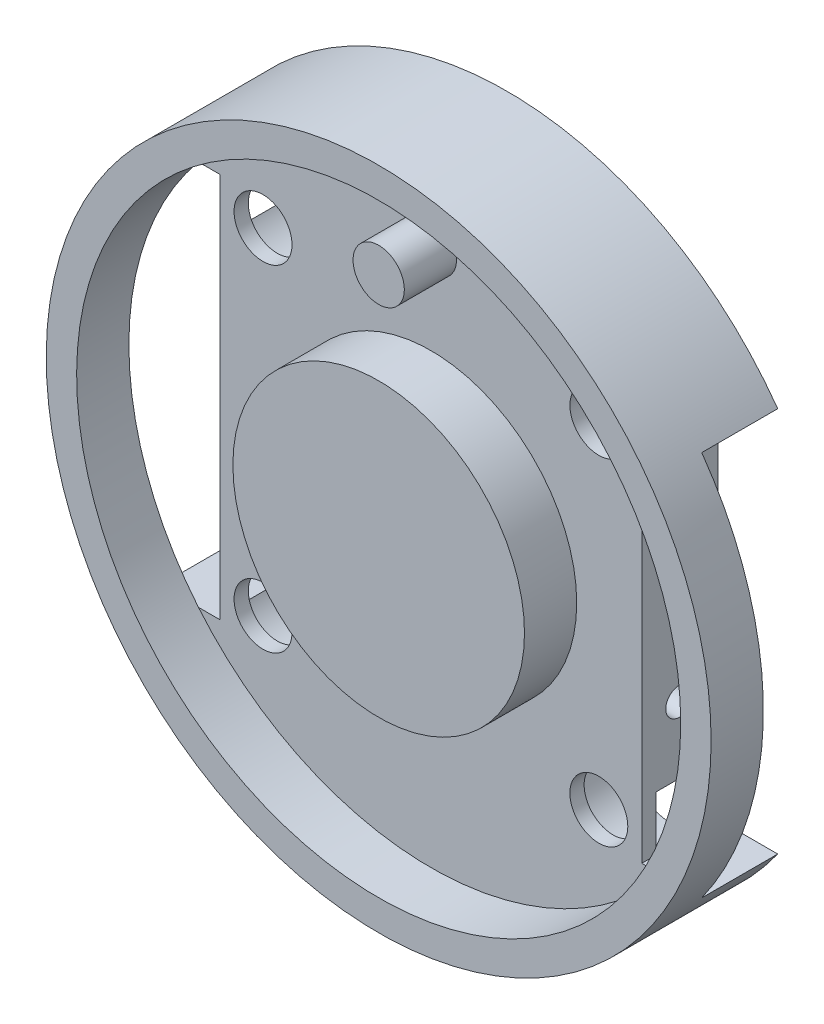
from build123d import *

# Parameters (mm, degrees)
BOSS_EXTRUDE1_DEPTH     = 8
CUT_EXTRUDE1_REACH      = 47.847
SKETCH2_R               = 3.05
SKETCH5_R               = 2.7
BOSS_EXTRUDE2_DEPTH     = 5.5
SKETCH6_R               = 15.35
BOSS_EXTRUDE3_DEPTH     = 5.5
SKETCH7_R               = 5.5
CUT_EXTRUDE2_DEPTH      = 6.5
CUT_EXTRUDE3_DEPTH      = 52.305457799
CUT_EXTRUDE3_DEPTH_BACK = 52.305457799
SKETCH8_R               = 1.475


with BuildPart() as part:
    # Sketch1 → Boss-Extrude1 (new body)
    with BuildSketch(Plane.XY):
        with BuildLine():
            Line((28.511576596, -20.3), (22.2, -20.3))
            Line((22.2, -20.3), (22.2, 20.3))
            Line((22.2, 20.3), (28.511576596, 20.3))
            ThreePointArc((28.511576596, 20.3), (0, 35), (-28.511576596, 20.3))
            Line((-28.511576596, 20.3), (-22.2, 20.3))
            Line((-22.2, 20.3), (-22.2, -20.3))
            Line((-22.2, -20.3), (-28.511576596, -20.3))
            ThreePointArc((-28.511576596, -20.3), (0, -35), (28.511576596, -20.3))
        make_face()
    extrude(amount=BOSS_EXTRUDE1_DEPTH)

    # Sketch2 → Cut-Extrude1 (cut, up to next)
    with BuildSketch(Plane.XY.offset(8), mode=Mode.PRIVATE) as cut_extrude1_sk1:
        with Locations((17.67766953, -17.67766953)):
            Circle(SKETCH2_R)
    cut_extrude1_tool1 = extrude(cut_extrude1_sk1.sketch, amount=-CUT_EXTRUDE1_REACH, mode=Mode.PRIVATE) & part.part
    # Sketch2 → Cut-Extrude1 (cut, up to next)
    with BuildSketch(Plane.XY.offset(8), mode=Mode.PRIVATE) as cut_extrude1_sk2:
        with Locations((17.67766953, 17.67766953)):
            Circle(SKETCH2_R)
    cut_extrude1_tool2 = extrude(cut_extrude1_sk2.sketch, amount=-CUT_EXTRUDE1_REACH, mode=Mode.PRIVATE) & part.part
    # Sketch2 → Cut-Extrude1 (cut, up to next)
    with BuildSketch(Plane.XY.offset(8), mode=Mode.PRIVATE) as cut_extrude1_sk3:
        with Locations((-17.67766953, 17.67766953)):
            Circle(SKETCH2_R)
    cut_extrude1_tool3 = extrude(cut_extrude1_sk3.sketch, amount=-CUT_EXTRUDE1_REACH, mode=Mode.PRIVATE) & part.part
    # Sketch2 → Cut-Extrude1 (cut, up to next)
    with BuildSketch(Plane.XY.offset(8), mode=Mode.PRIVATE) as cut_extrude1_sk4:
        with Locations((-17.67766953, -17.67766953)):
            Circle(SKETCH2_R)
    cut_extrude1_tool4 = extrude(cut_extrude1_sk4.sketch, amount=-CUT_EXTRUDE1_REACH, mode=Mode.PRIVATE) & part.part
    add(cut_extrude1_tool1.solids().sort_by_distance((17.67767, -17.67767, 8))[0], mode=Mode.SUBTRACT)
    add(cut_extrude1_tool2.solids().sort_by_distance((17.67767, 17.67767, 8))[0], mode=Mode.SUBTRACT)
    add(cut_extrude1_tool3.solids().sort_by_distance((-17.67767, 17.67767, 8))[0], mode=Mode.SUBTRACT)
    add(cut_extrude1_tool4.solids().sort_by_distance((-17.67767, -17.67767, 8))[0], mode=Mode.SUBTRACT)

    # Sketch5 → Boss-Extrude2 (add)
    with BuildSketch(Plane.XY.offset(8)):
        with BuildLine():
            ThreePointArc((-24.477540726, -20.3), (-31.8, 0), (-24.477540726, 20.3))
            Line((-24.477540726, 20.3), (-28.511576596, 20.3))
            ThreePointArc((-28.511576596, 20.3), (-35, 0), (-28.511576596, -20.3))
            Line((-28.511576596, -20.3), (-24.477540726, -20.3))
        make_face()
        with BuildLine():
            ThreePointArc((-24.477540726, 20.3), (0, 31.8), (24.477540726, 20.3))
            Line((24.477540726, 20.3), (28.511576596, 20.3))
            ThreePointArc((28.511576596, 20.3), (0, 35), (-28.511576596, 20.3))
            Line((-28.511576596, 20.3), (-24.477540726, 20.3))
        make_face()
        with BuildLine():
            ThreePointArc((24.477540726, 20.3), (29.913423367, 10.79013913), (31.8, 0))
            ThreePointArc((31.8, 0), (29.913423367, -10.79013913), (24.477540726, -20.3))
            Line((24.477540726, -20.3), (28.511576596, -20.3))
            ThreePointArc((28.511576596, -20.3), (33.33845513, -10.655862685), (35, 0))
            ThreePointArc((35, 0), (33.33845513, 10.655862685), (28.511576596, 20.3))
            Line((28.511576596, 20.3), (24.477540726, 20.3))
        make_face()
        with BuildLine():
            Line((28.511576596, -20.3), (24.477540726, -20.3))
            ThreePointArc((24.477540726, -20.3), (0, -31.8), (-24.477540726, -20.3))
            Line((-24.477540726, -20.3), (-28.511576596, -20.3))
            ThreePointArc((-28.511576596, -20.3), (0, -35), (28.511576596, -20.3))
        make_face()
        with Locations((0, 25)):
            Circle(SKETCH5_R)
    extrude(amount=BOSS_EXTRUDE2_DEPTH)

    # Sketch6 → Boss-Extrude3 (add)
    with BuildSketch(Plane.XY.offset(8)):
        with Locations(Location((0, 0, 0), (0, 0, 180))):
            Circle(SKETCH6_R)
    extrude(amount=BOSS_EXTRUDE3_DEPTH)

    # Sketch7 → Cut-Extrude2 (cut)
    with BuildSketch(Plane(origin=(0, 0, 0), x_dir=(-1, 0, 0), z_dir=(0, 0, -1))):
        with Locations((-17.67766953, 17.67766953)):
            Circle(SKETCH7_R)
        with Locations((17.67766953, 17.67766953)):
            Circle(SKETCH7_R)
        with Locations((17.67766953, -17.67766953)):
            Circle(SKETCH7_R)
        with Locations((-17.67766953, -17.67766953)):
            Circle(SKETCH7_R)
    extrude(amount=-CUT_EXTRUDE2_DEPTH, mode=Mode.SUBTRACT)

    # Sketch8 → Cut-Extrude3 (cut, two sides: drawn at the far end of the back side and taken through both)
    with BuildSketch(Plane(origin=(0, 0, 0), x_dir=(0, 0, -1), z_dir=(1, 0, 0)).offset(-CUT_EXTRUDE3_DEPTH_BACK)):
        with Locations(Location((-4, 7.5, 0), (0, 0, 90))):
            Circle(SKETCH8_R)
        with Locations(Location((-4, -7.5, 0), (0, 0, 90))):
            Circle(SKETCH8_R)
    extrude(amount=CUT_EXTRUDE3_DEPTH + CUT_EXTRUDE3_DEPTH_BACK, mode=Mode.SUBTRACT)


solid = part.part
